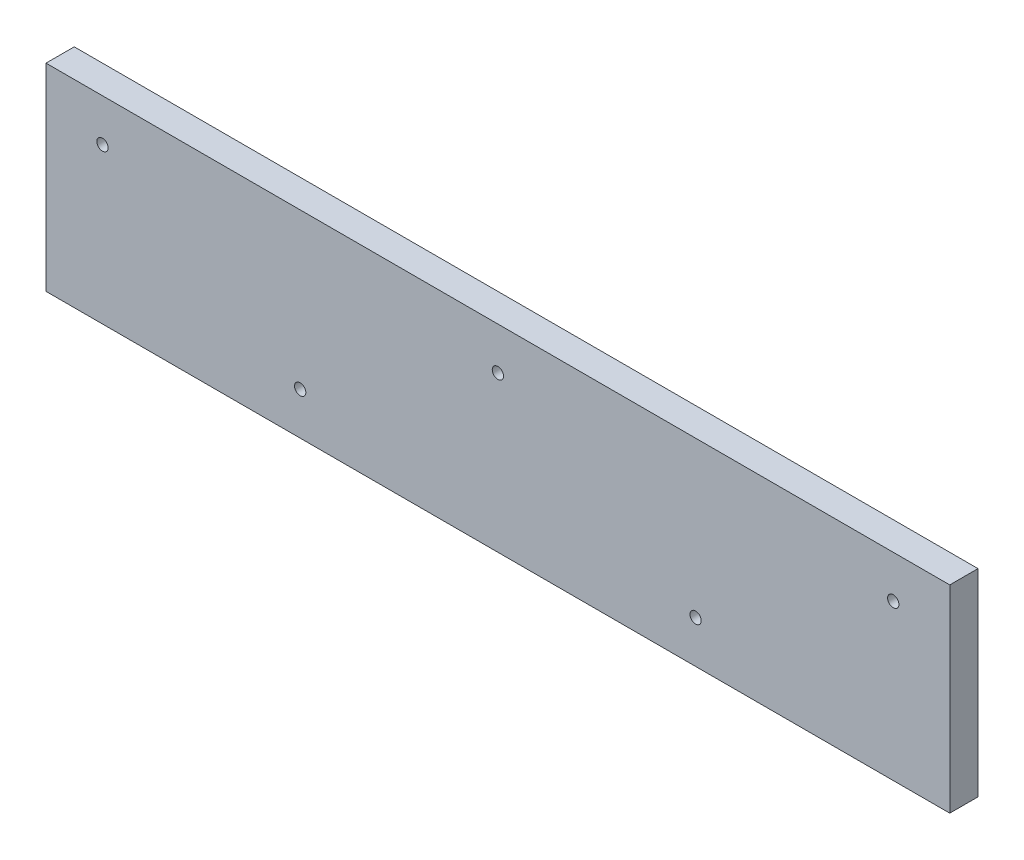
from build123d import *

# Parameters (mm, degrees)
ESQUISSE1_W                  = 320
ESQUISSE1_H                  = 70
BOSS_EXTRU_1_DEPTH           = 10
ENL_V_MAT_EXTRU_1_DEPTH      = 328.719392163
ENL_V_MAT_EXTRU_1_DEPTH_BACK = 328.719392163
ESQUISSE2_R                  = 2


with BuildPart() as part:
    # Esquisse1 → Boss.-Extru.1 (new body)
    with BuildSketch(Plane.XY):
        with Locations((160, 35)):
            Rectangle(ESQUISSE1_W, ESQUISSE1_H)
    extrude(amount=BOSS_EXTRU_1_DEPTH)

    # Esquisse2 → Enlèv. mat.-Extru.1 (cut, two sides: drawn at the far end of the back side and taken through both)
    with BuildSketch(Plane.XY.offset(10).offset(-ENL_V_MAT_EXTRU_1_DEPTH_BACK)):
        with Locations((160, 55)):
            Circle(ESQUISSE2_R)
        with Locations((90, 15)):
            Circle(ESQUISSE2_R)
        with Locations((20, 55)):
            Circle(ESQUISSE2_R)
        with Locations(Location((300, 55, 0), (0, 0, 180))):
            Circle(ESQUISSE2_R)
        with Locations(Location((230, 15, 0), (0, 0, 180))):
            Circle(ESQUISSE2_R)
    extrude(amount=ENL_V_MAT_EXTRU_1_DEPTH + ENL_V_MAT_EXTRU_1_DEPTH_BACK, mode=Mode.SUBTRACT)


solid = part.part
